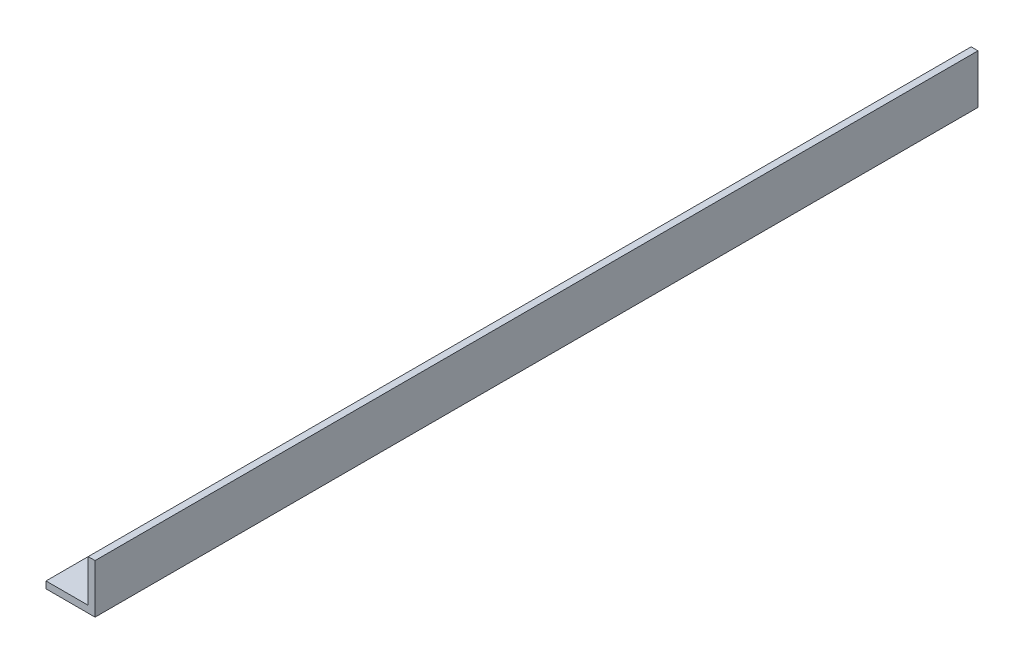
from build123d import *

# Parameters (mm, degrees)
BOSS_EXTRUDE1_DEPTH = 900


with BuildPart() as part:
    # Sketch1 → Boss-Extrude1 (new body)
    with BuildSketch(Plane.XY):
        Polygon((0, 0), (50, 0), (50, 50), (43, 50), (43, 7), (0, 7), align=None)
    extrude(amount=BOSS_EXTRUDE1_DEPTH)


solid = part.part
